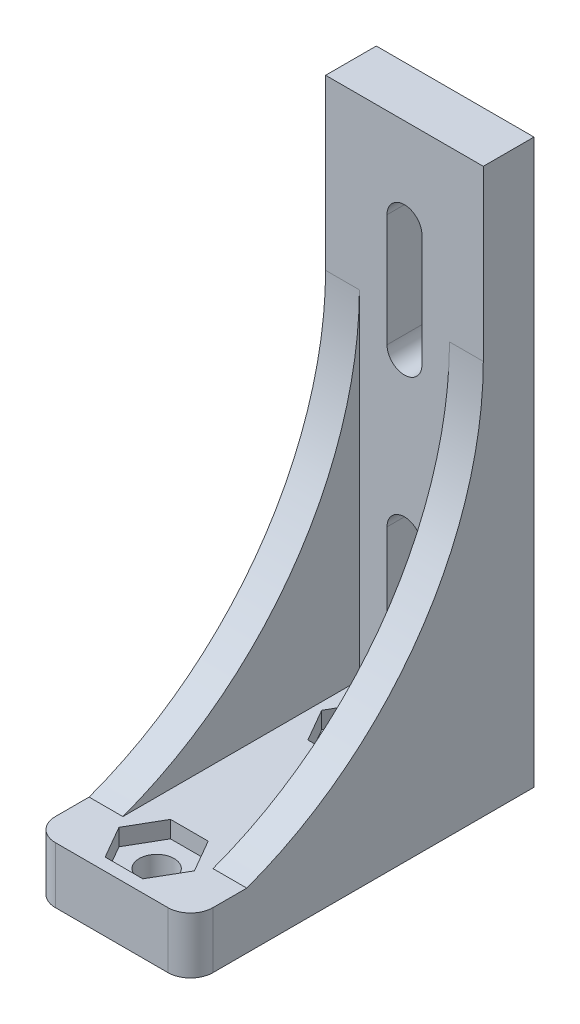
from build123d import *

# Parameters (mm, degrees)
CROQUIS2_W              = 14
CROQUIS2_H              = 31
CROQUIS2_R              = 1.55
SALIENTE_EXTRUIR1_DEPTH = 50
CORTAR_EXTRUIR1_REACH   = 62.473
CROQUIS3_W              = 26
CROQUIS3_H              = 45
CORTAR_EXTRUIR2_DEPTH   = 5
CORTAR_EXTRUIR3_DEPTH   = 1.5
SALIENTE_EXTRUIR3_START = -14
SALIENTE_EXTRUIR3_DEPTH = 14
CROQUIS7_OUTSIDE_W      = 28.094
CROQUIS7_OUTSIDE_H      = 45.094
CORTAR_EXTRUIR5_DEPTH   = 45
REDONDEO1_R             = 2
CORTAR_EXTRUIR6_REACH   = 62.473
CROQUIS8_W              = 14
CROQUIS8_H              = 0.5


with BuildPart() as part:
    # Croquis2 → Saliente-Extruir1 (new body)
    with BuildSketch(Plane(origin=(0, 0, 0), x_dir=(1, 0, 0), z_dir=(0, 1, 0))):
        with Locations((7, 15.5)):
            Rectangle(CROQUIS2_W, CROQUIS2_H)
        with Locations(Location((7, 22, 0), (0, 0, 270))):
            Circle(CROQUIS2_R, mode=Mode.SUBTRACT)
        with Locations(Location((7, 4, 0), (0, 0, 270))):
            Circle(CROQUIS2_R, mode=Mode.SUBTRACT)
    extrude(amount=SALIENTE_EXTRUIR1_DEPTH)

    # Cortar-Extruir1: up to this face of the body (flat: up to its plane)
    cortar_extruir1_end = Plane(part.part.faces().sort_by_distance((14, 25, -15.5))[0])
    # Croquis3 → Cortar-Extruir1 (cut, up to the picked face)
    with BuildSketch(Plane.ZY, mode=Mode.PRIVATE) as cortar_extruir1_sk1:
        with Locations((-13, 27.5)):
            Rectangle(CROQUIS3_W, CROQUIS3_H)
    cortar_extruir1_tool1 = split(extrude(cortar_extruir1_sk1.sketch, amount=-CORTAR_EXTRUIR1_REACH, mode=Mode.PRIVATE), bisect_by=cortar_extruir1_end, keep=Keep.BOTH, mode=Mode.PRIVATE)
    add(cortar_extruir1_tool1.solids().sort_by(Axis((0, 27.5, -13), (1, 0, 0)))[0], mode=Mode.SUBTRACT)

    # Croquis4 → Cortar-Extruir2 (cut)
    with BuildSketch(Plane(origin=(0, 0, -31), x_dir=(-1, 0, 0), z_dir=(0, 0, -1))):
        with BuildLine():
            Line((-8.55, 8), (-8.55, 18))
            ThreePointArc((-8.55, 18), (-7, 19.55), (-5.45, 18))
            Line((-5.45, 18), (-5.45, 8))
            ThreePointArc((-5.45, 8), (-7, 6.45), (-8.55, 8))
        make_face()
        with BuildLine():
            Line((-8.55, 32), (-8.55, 42))
            ThreePointArc((-8.55, 42), (-7, 43.55), (-5.45, 42))
            Line((-5.45, 42), (-5.45, 32))
            ThreePointArc((-5.45, 32), (-7, 30.45), (-8.55, 32))
        make_face()
    extrude(amount=-CORTAR_EXTRUIR2_DEPTH, mode=Mode.SUBTRACT)

    # Croquis5 → Cortar-Extruir3 (cut)
    with BuildSketch(Plane(origin=(0, 5, 0), x_dir=(1, 0, 0), z_dir=(0, 1, 0))):
        Polygon((10.348631561, 4), (8.674315781, 6.9), (5.325684219, 6.9), (3.651368439, 4), (5.325684219, 1.1), (8.674315781, 1.1), align=None)
        Polygon((8.674315781, 19.1), (10.348631561, 22), (8.674315781, 24.9), (5.325684219, 24.9), (3.651368439, 22), (5.325684219, 19.1), align=None)
    extrude(amount=-CORTAR_EXTRUIR3_DEPTH, mode=Mode.SUBTRACT)

    # Croquis6 → Saliente-Extruir3 (add)
    with BuildSketch(Plane.ZY.offset(SALIENTE_EXTRUIR3_START)):
        with BuildLine():
            Line((-26, 5), (-26, 35))
            ThreePointArc((-26, 35), (-20.21590319, 16.698867767), (-5, 5))
            Line((-5, 5), (-26, 5))
        make_face()
    extrude(amount=SALIENTE_EXTRUIR3_DEPTH)

    # Croquis7 outside → Cortar-Extruir5 (cut)
    with BuildSketch(Plane(origin=(0, 50, 0), x_dir=(1, 0, 0), z_dir=(0, 1, 0))):
        with Locations((7, 15.5)):
            Rectangle(CROQUIS7_OUTSIDE_W, CROQUIS7_OUTSIDE_H)
        Polygon((0, 26), (0, 0), (3, 0), (3, 26), (11, 26), (11, 0), (14, 0), (14, 26), (14, 31), (0, 31), align=None, mode=Mode.SUBTRACT)
    extrude(amount=-CORTAR_EXTRUIR5_DEPTH, mode=Mode.SUBTRACT)

    # Redondeo1
    redondeo1_edges = [part.edges().sort_by_distance(p)[0] for p in [
        (14, 2.5, 0),
        (0, 2.5, 0),
    ]]
    fillet(redondeo1_edges, radius=REDONDEO1_R)

    # Cortar-Extruir6: up to this face of the body (flat: up to its plane)
    cortar_extruir6_end = Plane(part.part.faces().sort_by_distance((7, 0, -15.652406283))[0])
    # Croquis8 → Cortar-Extruir6 (cut, up to the picked face)
    with BuildSketch(Plane(origin=(0, 50, 0), x_dir=(1, 0, 0), z_dir=(0, 1, 0)), mode=Mode.PRIVATE) as cortar_extruir6_sk1:
        with Locations((7, 30.75)):
            Rectangle(CROQUIS8_W, CROQUIS8_H)
    cortar_extruir6_tool1 = split(extrude(cortar_extruir6_sk1.sketch, amount=-CORTAR_EXTRUIR6_REACH, mode=Mode.PRIVATE), bisect_by=cortar_extruir6_end, keep=Keep.BOTH, mode=Mode.PRIVATE)
    add(cortar_extruir6_tool1.solids().sort_by(Axis((7, 50, -30.75), (0, -1, 0)))[0], mode=Mode.SUBTRACT)


solid = part.part
